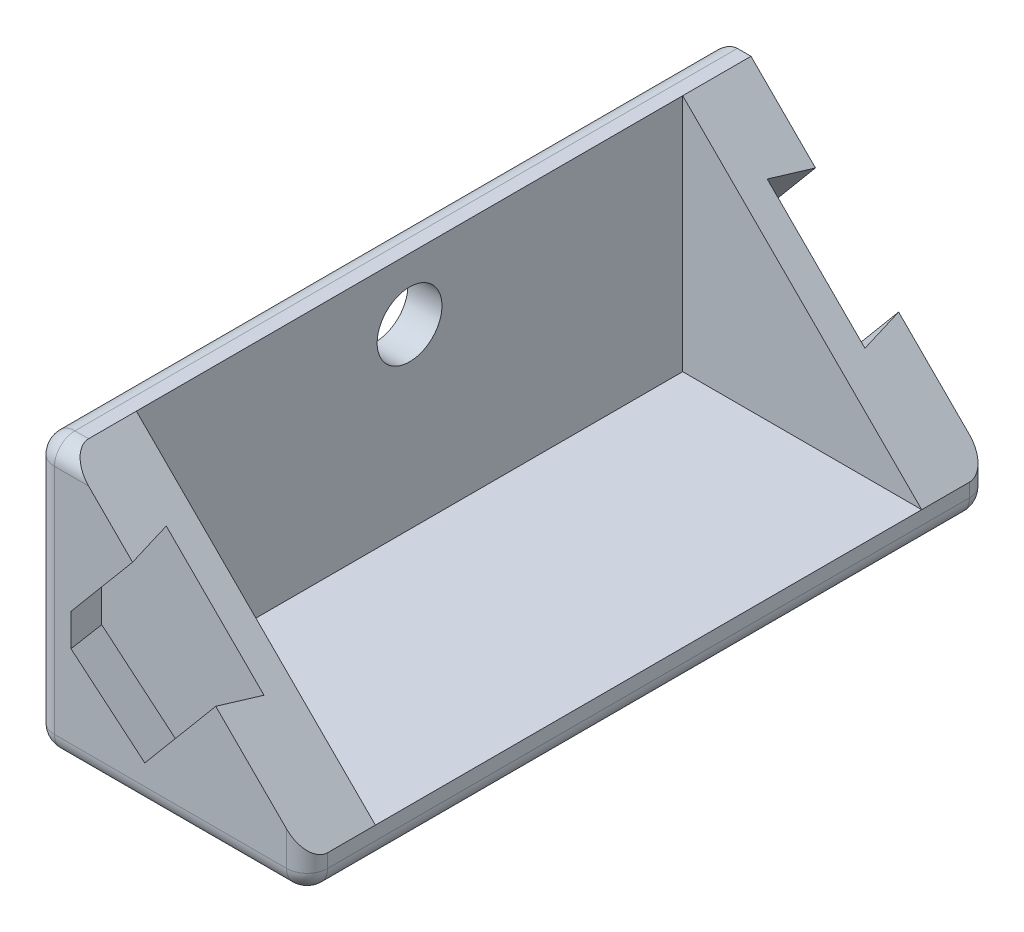
from build123d import *

# Parameters (mm, degrees)
EXTRUDE_1_DEPTH     = 10
EXTRUDE_3_DEPTH     = 40
FILLET_2_R          = 3
FILLET_3_R          = 3
SKETCH_13_R         = 4.75
CUT_EXTRUDE_3_DEPTH = 10


with BuildPart() as part:
    # 草图3 → 凸台-拉伸1 (new body)
    with BuildSketch(Plane.XY):
        Polygon((-100, -79.175359259), (-100, -119.175359259), (-60, -119.175359259), (-60, -114.175359259), (-95, -79.175359259), align=None)
    extrude(amount=-EXTRUDE_1_DEPTH)

    # 草图5 → 切除-放样1 section 0
    with BuildSketch(Plane.XY.offset(-6)):
        with BuildLine():
            Line((-96.08, -104.799041882), (-96.08, -98.821989002))
            Line((-96.08, -98.821989002), (-81.709132385, -81.695455893))
            Line((-81.709132385, -81.695455893), (-66.265676412, -94.654054104))
            Line((-66.265676412, -94.654054104), (-83.579668035, -115.288065824))
            Line((-83.579668035, -115.288065824), (-96.08, -104.799041882))
        make_face()
    # 草图8 → 切除-放样1 section 1
    with BuildSketch(Plane.XY):
        with BuildLine():
            Line((-94.58, -104.099580395), (-94.58, -99.367944353))
            Line((-94.58, -99.367944353), (-80.56006572, -82.659637307))
            Line((-80.56006572, -82.659637307), (-67.414743077, -93.68987269))
            Line((-67.414743077, -93.68987269), (-83.764553285, -113.174817744))
            Line((-83.764553285, -113.174817744), (-94.58, -104.099580395))
        make_face()
    loft(mode=Mode.SUBTRACT)

    # 草图9 → 凸台-拉伸3 (add)
    with BuildSketch(Plane(origin=(0, 0, -10), x_dir=(-1, 0, 0), z_dir=(0, 0, -1))):
        Polygon((95, -79.175359259), (95, -114.175359259), (60, -114.175359259), (60, -119.175359259), (100, -119.175359259), (100, -79.175359259), align=None)
    extrude(amount=EXTRUDE_3_DEPTH)

    # 镜向2: part across plane


with BuildPart() as part_1:
    add(part.part)
    add(part.part.mirror(Plane(origin=(0, 0, -50), x_dir=(1, 0, 0), z_dir=(0, 0, -1))))

    # 圆角2
    fillet_2_edges = [part_1.edges().sort_by_distance(p)[0] for p in [
        (-60, -116.675359259, -100),
        (-60, -116.675359259, 0),
        (-100, -99.175359259, -100),
        (-100, -99.175359259, 0),
        (-100, -79.175359259, -50),
        (-97.5, -79.175359259, 0),
    ]]
    fillet(fillet_2_edges, radius=FILLET_2_R)

    # 圆角3
    fillet_3_edges = [part_1.edges().sort_by_distance(p)[0] for p in [
        (-80, -119.175359259, -100),
        (-80, -119.175359259, 0),
        (-100, -119.175359259, -50),
        (-60, -119.175359259, -50),
        (-99.121320344, -119.175359259, -0.878679656),
        (-99.121320344, -119.175359259, -99.121320344),
        (-60.878679656, -119.175359259, -0.878679656),
        (-60.878679656, -119.175359259, -99.121320344),
    ]]
    fillet(fillet_3_edges, radius=FILLET_3_R)

    # 草图13 → 切除-拉伸3 (cut)
    with BuildSketch(Plane.ZY.offset(100)):
        with Locations((-50, -88.175359259)):
            Circle(SKETCH_13_R)
    extrude(amount=-CUT_EXTRUDE_3_DEPTH, mode=Mode.SUBTRACT)


solid = part_1.part
